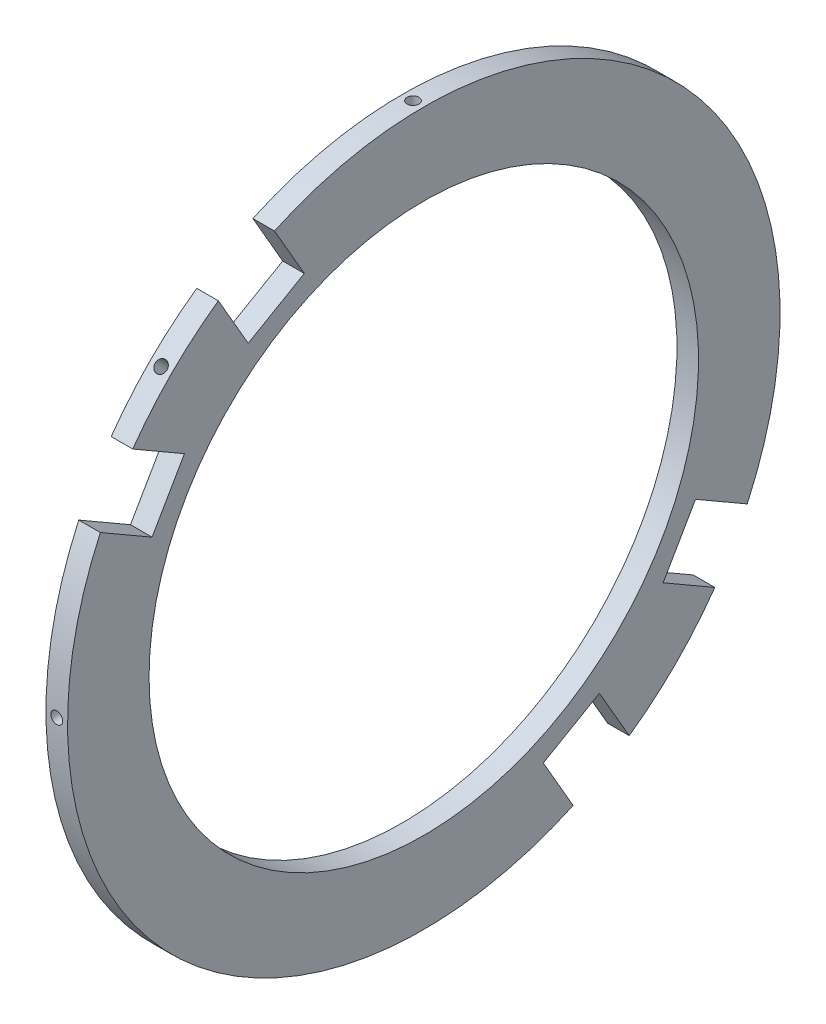
from build123d import *

# Parameters (mm, degrees)
RING_SKETCH_W        = 6
RING_SKETCH_H        = 22.65
NOTCH_30_DEPTH       = 6
NOTCH_60_DEPTH       = 6
NOTCH_210_DEPTH      = 6
NOTCH_240_DEPTH      = 6
SCREW_HOLE_SKETCH_W  = 1.65
SCREW_HOLE_SKETCH_H  = 9
SCREW_HOLES_X8_COUNT = 8


with BuildPart() as part:
    # Ring Sketch → Ring (revolve)
    with BuildSketch(Plane.XY):
        with Locations((0, 87.675)):
            Rectangle(RING_SKETCH_W, RING_SKETCH_H)
    revolve(axis=Axis((-1000, 0, 0), (1, 0, 0)))

    # Notch 30 Sketch → Notch 30 (cut)
    with BuildSketch(Plane(origin=(3, 0, 0), x_dir=(0, 0, -1), z_dir=(1, 0, 0))):
        Polygon((-48.794228634, 66.51408311), (-33.205771366, 75.51408311), (-42.705771366, 91.968565782), (-58.294228634, 82.968565782), align=None)
    extrude(amount=-NOTCH_30_DEPTH, mode=Mode.SUBTRACT)

    # Notch 60 Sketch → Notch 60 (cut)
    with BuildSketch(Plane(origin=(3, 0, 0), x_dir=(0, 0, -1), z_dir=(1, 0, 0))):
        Polygon((-75.51408311, 33.205771366), (-66.51408311, 48.794228634), (-82.968565782, 58.294228634), (-91.968565782, 42.705771366), align=None)
    extrude(amount=-NOTCH_60_DEPTH, mode=Mode.SUBTRACT)

    # Notch 210 Sketch → Notch 210 (cut)
    with BuildSketch(Plane(origin=(3, 0, 0), x_dir=(0, 0, -1), z_dir=(1, 0, 0))):
        Polygon((48.794228634, -66.51408311), (33.205771366, -75.51408311), (42.705771366, -91.968565782), (58.294228634, -82.968565782), align=None)
    extrude(amount=-NOTCH_210_DEPTH, mode=Mode.SUBTRACT)

    # Notch 240 Sketch → Notch 240 (cut)
    with BuildSketch(Plane(origin=(3, 0, 0), x_dir=(0, 0, -1), z_dir=(1, 0, 0))):
        Polygon((75.51408311, -33.205771366), (66.51408311, -48.794228634), (82.968565782, -58.294228634), (91.968565782, -42.705771366), align=None)
    extrude(amount=-NOTCH_240_DEPTH, mode=Mode.SUBTRACT)

    # Screw Hole Sketch → Screw Hole (revolve, cut)
    with BuildSketch(Plane.XY):
        with Locations((0.825, 95.5)):
            Rectangle(SCREW_HOLE_SKETCH_W, SCREW_HOLE_SKETCH_H)
    screw_hole = revolve(axis=Axis((0, 30, 0), (0, 1, 0)), mode=Mode.SUBTRACT)

    # Screw Holes x8: Screw Hole ×8 about axis
    screw_holes_x8_axis = Axis((3.3, 0, 0), (-1, 0, 0))
    for i in range(1, SCREW_HOLES_X8_COUNT):
        add(screw_hole.rotate(screw_holes_x8_axis, i * 360 / SCREW_HOLES_X8_COUNT), mode=Mode.SUBTRACT)


solid = part.part
